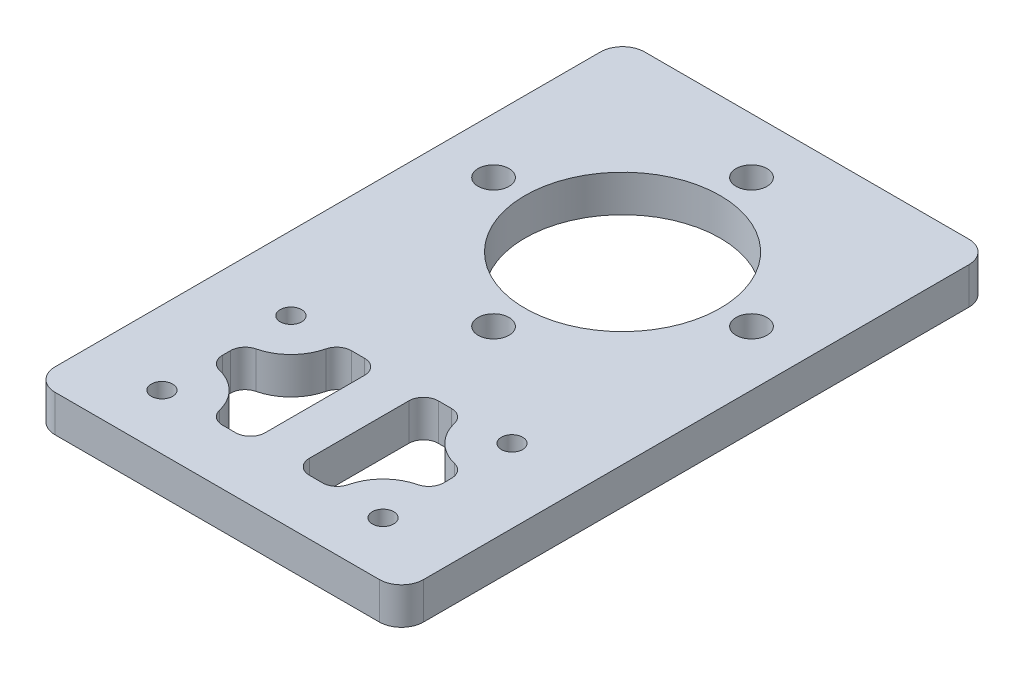
from build123d import *

# Parameters (mm, degrees)
SKETCH_1_W          = 50
SKETCH_1_H          = 50
SKETCH_1_R          = 21.05
EXTRUDE_1_DEPTH     = 5
SKETCH_2_W          = 50
SKETCH_2_H          = 30
SKETCH_2_R          = 1.45
EXTRUDE_2_DEPTH     = 5
FILLET_1_R          = 3
EXTRUDE_START       = -5
SKETCH_4_R          = 21.05
EXTRUDE_3_DEPTH     = 5
SKETCH_5_R          = 13.25
SKETCH_5_R_2        = 2.1
CUT_EXTRUDE_2_DEPTH = 61.621778265
SKETCH_6_R          = 1.45
CUT_EXTRUDE_3_DEPTH = 61.621778265
CUT_EXTRUDE_4_DEPTH = 61.621778265
SKETCH_8_W          = 6
SKETCH_8_H          = 17.5
EXTRUDE_4_DEPTH     = 5
FILLET_2_R          = 2


with BuildPart() as part:
    # 草图1 → 凸台-拉伸1 (new body)
    with BuildSketch(Plane(origin=(0, 0, 0), x_dir=(1, 0, 0), z_dir=(0, 1, 0))):
        Rectangle(SKETCH_1_W, SKETCH_1_H)
        with Locations(Location((0, 0, 0), (0, 0, 270))):
            Circle(SKETCH_1_R, mode=Mode.SUBTRACT)
    extrude(amount=EXTRUDE_1_DEPTH)

    # 草图2 → 凸台-拉伸2 (add)
    with BuildSketch(Plane(origin=(0, 5, 0), x_dir=(1, 0, 0), z_dir=(0, 1, 0))):
        with Locations((0, -40)):
            Rectangle(SKETCH_2_W, SKETCH_2_H)
        with Locations(Location((-15, -47.5, 0), (0, 0, 270))):
            Circle(SKETCH_2_R, mode=Mode.SUBTRACT)
        with Locations(Location((15, -47.5, 0), (0, 0, 270))):
            Circle(SKETCH_2_R, mode=Mode.SUBTRACT)
    extrude(amount=-EXTRUDE_2_DEPTH)

    # 圆角1
    fillet_1_edges = [part.edges().sort_by_distance(p)[0] for p in [
        (25, 2.5, 55),
        (-25, 2.5, 55),
        (-25, 2.5, -25),
        (25, 2.5, -25),
    ]]
    fillet(fillet_1_edges, radius=FILLET_1_R)

    # 草图4 → 凸台-拉伸3 (add)
    with BuildSketch(Plane(origin=(0, 5, 0), x_dir=(1, 0, 0), z_dir=(0, 1, 0)).offset(EXTRUDE_START)):
        Circle(SKETCH_4_R)
    extrude(amount=EXTRUDE_3_DEPTH)

    # 草图5 → 切除-拉伸2 (cut, through all)
    with BuildSketch(Plane.XZ):
        with Locations(Location((0, 0, 0), (0, 0, 270))):
            Circle(SKETCH_5_R)
        with Locations(Location((0, 17.5, 0), (0, 0, 270))):
            Circle(SKETCH_5_R_2)
        with Locations(Location((17.5, 0, 0), (0, 0, 270))):
            Circle(SKETCH_5_R_2)
        with Locations(Location((0, -17.5, 0), (0, 0, 270))):
            Circle(SKETCH_5_R_2)
        with Locations(Location((-17.5, 0, 0), (0, 0, 270))):
            Circle(SKETCH_5_R_2)
    extrude(amount=-CUT_EXTRUDE_2_DEPTH, mode=Mode.SUBTRACT)

    # 草图6 → 切除-拉伸3 (cut, through all)
    with BuildSketch(Plane(origin=(0, 5, 0), x_dir=(1, 0, 0), z_dir=(0, 1, 0))):
        with Locations(Location((-15, -30, 0), (0, 0, 270))):
            Circle(SKETCH_6_R)
        with Locations(Location((15, -30, 0), (0, 0, 270))):
            Circle(SKETCH_6_R)
    extrude(amount=-CUT_EXTRUDE_3_DEPTH, mode=Mode.SUBTRACT)

    # 草图7 → 切除-拉伸4 (cut, through all)
    with BuildSketch(Plane(origin=(0, 5, 0), x_dir=(1, 0, 0), z_dir=(0, 1, 0))):
        with BuildLine():
            Line((8.55, -30), (-8.55, -30))
            ThreePointArc((-8.55, -30), (-10.439161261, -34.560838739), (-15, -36.45))
            Line((-15, -36.45), (-15, -41.05))
            ThreePointArc((-15, -41.05), (-10.439161261, -42.939161261), (-8.55, -47.5))
            Line((-8.55, -47.5), (8.55, -47.5))
            ThreePointArc((8.55, -47.5), (10.439161261, -42.939161261), (15, -41.05))
            Line((15, -41.05), (15, -36.45))
            ThreePointArc((15, -36.45), (10.439161261, -34.560838739), (8.55, -30))
        make_face()
    extrude(amount=-CUT_EXTRUDE_4_DEPTH, mode=Mode.SUBTRACT)

    # 草图8 → 凸台-拉伸4 (add)
    with BuildSketch(Plane(origin=(0, 5, 0), x_dir=(1, 0, 0), z_dir=(0, 1, 0))):
        with Locations((0, -38.75)):
            Rectangle(SKETCH_8_W, SKETCH_8_H)
    extrude(amount=-EXTRUDE_4_DEPTH)

    # 圆角2
    fillet_2_edges = [part.edges().sort_by_distance(p)[0] for p in [
        (-8.55, 2.5, 47.5),
        (-15, 2.5, 41.05),
        (-15, 2.5, 36.45),
        (-8.55, 2.5, 30),
        (8.55, 2.5, 30),
        (15, 2.5, 36.45),
        (15, 2.5, 41.05),
        (8.55, 2.5, 47.5),
        (-3, 2.5, 30),
        (3, 2.5, 30),
        (3, 2.5, 47.5),
        (-3, 2.5, 47.5),
    ]]
    fillet(fillet_2_edges, radius=FILLET_2_R)


solid = part.part
